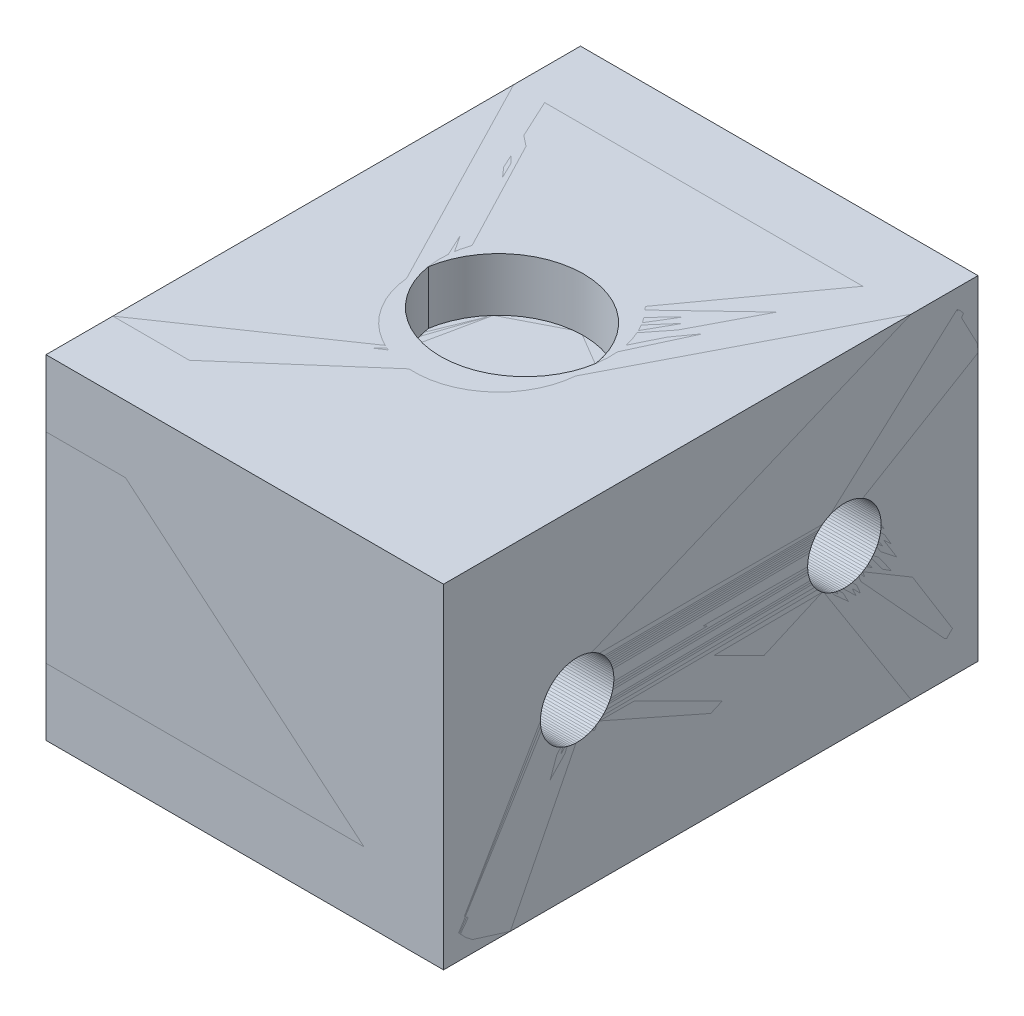
from build123d import *

# Parameters (mm, degrees)
ESQUISSE2_W             = 29.75
ESQUISSE2_H             = 25
BOSS_EXTRU_1_DEPTH      = 40
ESQUISSE3_R             = 6.35
ENL_V_MAT_EXTRU_1_DEPTH = 4
D_GAGEMENT_M51_D        = 5.5
CONG_1_R                = 5


with BuildPart() as part:
    # Esquisse2 → Boss.-Extru.1 (new body)
    with BuildSketch(Plane.XY):
        with Locations((-14.875, 87.5)):
            Rectangle(ESQUISSE2_W, ESQUISSE2_H)
    extrude(amount=-BOSS_EXTRU_1_DEPTH)

    # Esquisse3 → Enlèv. mat.-Extru.1 (cut)
    with BuildSketch(Plane(origin=(0, 100, 0), x_dir=(1, 0, 0), z_dir=(0, 1, 0))):
        with Locations(Location((-14.875, 21, 0), (0, 0, 270))):
            Circle(ESQUISSE3_R)
    extrude(amount=-ENL_V_MAT_EXTRU_1_DEPTH, mode=Mode.SUBTRACT)

    # Dégagement M51 (through all)
    with Locations(Plane(origin=(0, 87.5, -10), x_dir=(0, 1, 0), z_dir=(1, 0, 0))):
        with Locations((0, 0), (0, -20)):
            Hole(D_GAGEMENT_M51_D / 2)

    # Congé1
    cong_1_edges = [part.edges().sort_by_distance(p)[0] for p in [
        (-14.875, 75, 0),
        (-14.875, 100, 0),
    ]]
    fillet(cong_1_edges, radius=CONG_1_R)


with BuildPart() as body_2:
    # Symétrie1: mirrored copy
    add(part.part.mirror(Plane.XY.offset(-20)))


solid = Compound([part.part, body_2.part])
